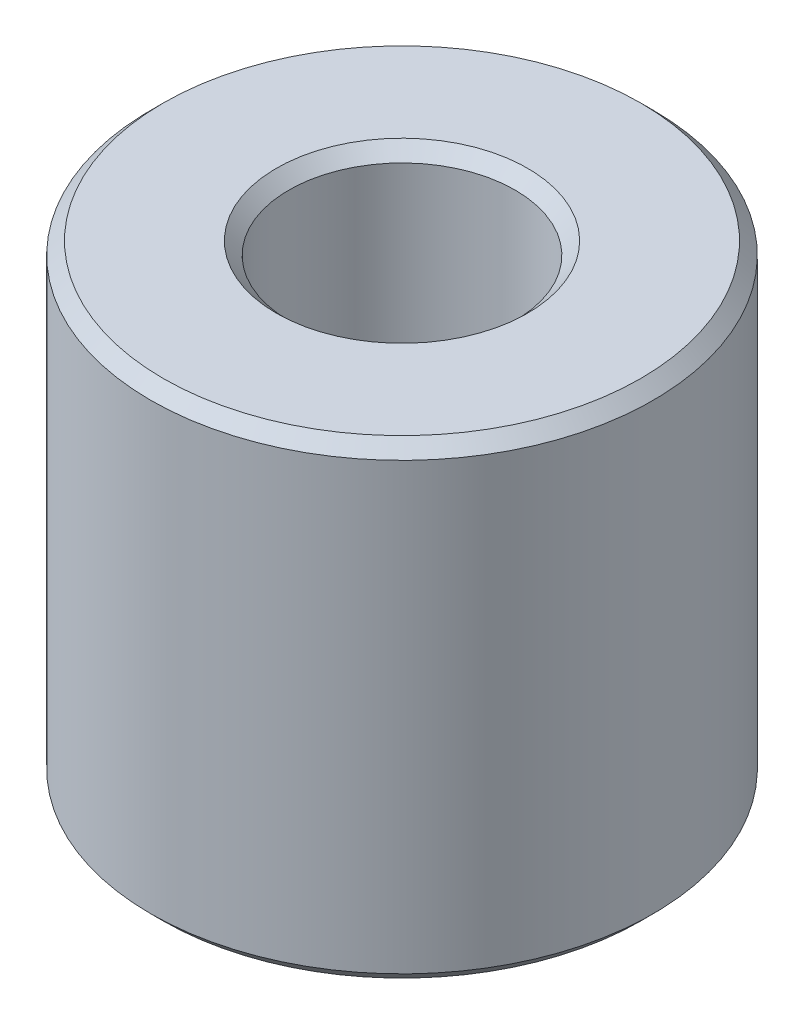
from build123d import *

# Parameters (mm, degrees)
SKETCH1_R     = 10
SKETCH1_R_2   = 4.5
BODY_DEPTH    = 18.7
CHAMFER1_SIZE = 0.5


with BuildPart() as part:
    # Sketch1 → Body (new body)
    with BuildSketch(Plane(origin=(0, 0, 0), x_dir=(1, 0, 0), z_dir=(0, 1, 0))):
        with Locations(Location((0, 0, 0), (0, 0, 270))):
            Circle(SKETCH1_R)
        with Locations(Location((0, 0, 0), (0, 0, 270))):
            Circle(SKETCH1_R_2, mode=Mode.SUBTRACT)
    extrude(amount=BODY_DEPTH)

    # Chamfer1
    chamfer1_edges = [part.edges().sort_by_distance(p)[0] for p in [
        (0, 0, -10),
        (0, 18.7, -10),
        (0, 0, -4.5),
        (0, 18.7, -4.5),
    ]]
    chamfer(chamfer1_edges, length=CHAMFER1_SIZE)


solid = part.part
